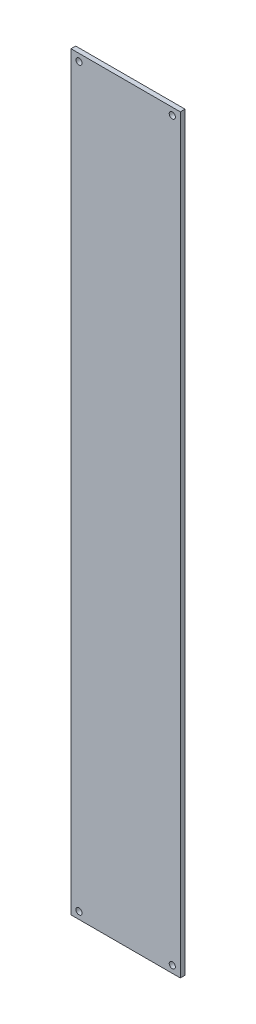
from build123d import *

# Parameters (mm, degrees)
SCHIZZO1_W                   = 116
SCHIZZO1_H                   = 796
SCHIZZO1_R                   = 3.25
ESTRUSIONE_ESTRUSIONE1_DEPTH = 5


with BuildPart() as part:
    # Schizzo1 → Estrusione-Estrusione1 (new body)
    with BuildSketch(Plane.XY.offset(5)):
        with Locations((-60.5, 200.5)):
            Rectangle(SCHIZZO1_W, SCHIZZO1_H)
        with Locations(Location((-110, -190, 0), (0, 0, 180))):
            Circle(SCHIZZO1_R, mode=Mode.SUBTRACT)
        with Locations(Location((-110, 591, 0), (0, 0, 180))):
            Circle(SCHIZZO1_R, mode=Mode.SUBTRACT)
        with Locations(Location((-11, 591, 0), (0, 0, 180))):
            Circle(SCHIZZO1_R, mode=Mode.SUBTRACT)
        with Locations(Location((-11, -190, 0), (0, 0, 180))):
            Circle(SCHIZZO1_R, mode=Mode.SUBTRACT)
    extrude(amount=-ESTRUSIONE_ESTRUSIONE1_DEPTH)


solid = part.part
